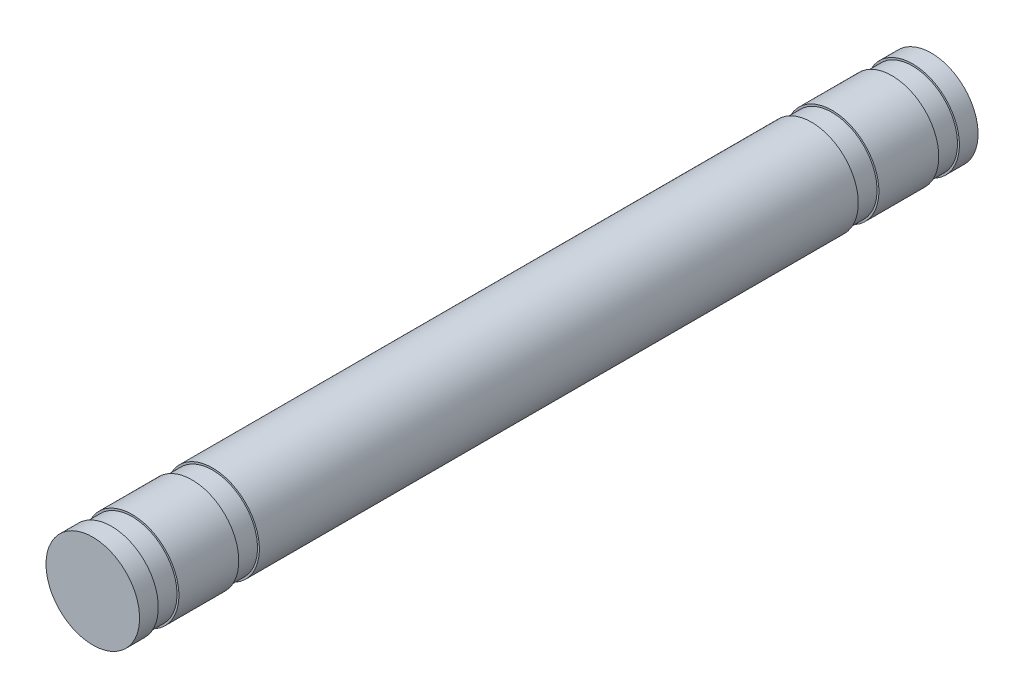
from build123d import *


with BuildPart() as part:
    # Sketch1 → Revolve1 (revolve)
    with BuildSketch(Plane(origin=(0, 0, 0), x_dir=(1, 0, 0), z_dir=(0, 1, 0))):
        Polygon((0, 0), (-2.5, 0), (-2.5, 1), (-2.4, 1), (-2.4, 2.1), (-2.5, 2.1), (-2.5, 5.3), (-2.4, 5.3), (-2.4, 6.4), (-2.5, 6.4), (-2.5, 38.4), (-2.4, 38.4), (-2.4, 39.5), (-2.5, 39.5), (-2.5, 42.7), (-2.4, 42.7), (-2.4, 43.8), (-2.5, 43.8), (-2.5, 44.8), (0, 44.8), align=None)
    revolve(axis=Axis((0, 0, -44.8), (0, 0, 1)))


solid = part.part
